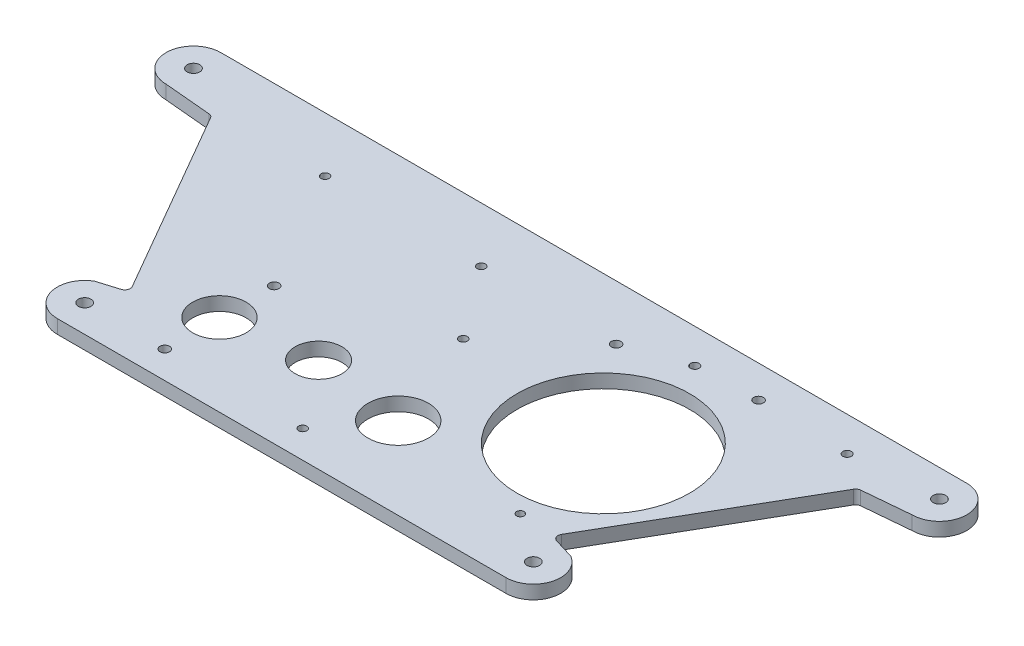
from build123d import *

# Parameters (mm, degrees)
SKETCH1_R           = 2.921
SKETCH1_R_2         = 2.2352
SKETCH1_R_3         = 12.3825
SKETCH1_R_4         = 10.8585
SKETCH1_R_5         = 14.0335
SKETCH1_R_6         = 1.7653
SKETCH1_R_7         = 40.0685
SKETCH1_R_8         = 1.9939
BOSS_EXTRUDE1_DEPTH = 6.35
SKETCH2_R           = 1.89865
CUT_EXTRUDE1_DEPTH  = 200.611442467
FILLET1_R           = 2.54


with BuildPart() as part:
    # Sketch1 → Boss-Extrude1 (new body)
    with BuildSketch(Plane(origin=(0, 0, 0), x_dir=(1, 0, 0), z_dir=(0, 1, 0))):
        with BuildLine():
            ThreePointArc((-173.185393891, 72.463962089), (-185.885393891, 59.763962089), (-173.185393891, 47.063962089))
            Line((-173.185393891, 47.063962089), (-149.978045472, 44.967655518))
            Line((-149.978045472, 44.967655518), (-98.053869436, -44.967655518))
            Line((-98.053869436, -44.967655518), (-110.525914692, -48.765439461))
            ThreePointArc((-110.525914692, -48.765439461), (-116.443172686, -63.050963961), (-104.175914692, -72.463962089))
            Line((-104.175914692, -72.463962089), (104.175914692, -72.463962089))
            ThreePointArc((104.175914692, -72.463962089), (116.443172686, -63.050963961), (110.525914692, -48.765439461))
            Line((110.525914692, -48.765439461), (98.053869436, -44.967655518))
            Line((98.053869436, -44.967655518), (149.978045472, 44.967655518))
            Line((149.978045472, 44.967655518), (173.185393891, 47.063962089))
            ThreePointArc((173.185393891, 47.063962089), (185.885393891, 59.763962089), (173.185393891, 72.463962089))
            Line((173.185393891, 72.463962089), (-173.185393891, 72.463962089))
        make_face()
        with Locations(Location((173.185393891, 59.763962089, 0), (0, 0, 270))):
            Circle(SKETCH1_R, mode=Mode.SUBTRACT)
        with Locations(Location((-104.175914692, -59.763962089, 0), (0, 0, 270))):
            Circle(SKETCH1_R, mode=Mode.SUBTRACT)
        with Locations(Location((-66.986243512, -59.763962089, 0), (0, 0, 270))):
            Circle(SKETCH1_R_2, mode=Mode.SUBTRACT)
        with Locations(Location((-66.986243512, -34.363962089, 0), (0, 0, 270))):
            Circle(SKETCH1_R_3, mode=Mode.SUBTRACT)
        with Locations(Location((-26.765079253, -28.544379147, 0), (0, 0, 270))):
            Circle(SKETCH1_R_4, mode=Mode.SUBTRACT)
        with Locations(Location((-66.986243512, -8.963962089, 0), (0, 0, 270))):
            Circle(SKETCH1_R_2, mode=Mode.SUBTRACT)
        with Locations(Location((16.020956488, -34.363962089, 0), (0, 0, 270))):
            Circle(SKETCH1_R_5, mode=Mode.SUBTRACT)
        with Locations(Location((81.81843836, -43.438397329, 0), (0, 0, 270))):
            Circle(SKETCH1_R_6, mode=Mode.SUBTRACT)
        with Locations(Location((-173.185393891, 59.763962089, 0), (0, 0, 270))):
            Circle(SKETCH1_R, mode=Mode.SUBTRACT)
        with Locations(Location((72.790674122, 4.112206637, 0), (0, 0, 270))):
            Circle(SKETCH1_R_7, mode=Mode.SUBTRACT)
        with Locations(Location((35.857528241, 46.975232392, 0), (0, 0, 270))):
            Circle(SKETCH1_R_2, mode=Mode.SUBTRACT)
        with Locations(Location((62.841482041, 56.516110851, 0), (0, 0, 270))):
            Circle(SKETCH1_R_8, mode=Mode.SUBTRACT)
        with Locations(Location((91.444570369, 57.528762089, 0), (0, 0, 270))):
            Circle(SKETCH1_R_2, mode=Mode.SUBTRACT)
        with Locations(Location((133.608398757, 56.516110851, 0), (0, 0, 270))):
            Circle(SKETCH1_R_8, mode=Mode.SUBTRACT)
        with Locations(Location((104.175914692, -59.763962089, 0), (0, 0, 270))):
            Circle(SKETCH1_R, mode=Mode.SUBTRACT)
    extrude(amount=BOSS_EXTRUDE1_DEPTH)

    # Sketch2 → Cut-Extrude1 (cut, through all)
    with BuildSketch(Plane(origin=(0, 6.35, 0), x_dir=(1, 0, 0), z_dir=(0, 1, 0))):
        with Locations(Location((-99.282752504, 46.975232392, 0), (0, 0, 270))):
            Circle(SKETCH2_R)
        with Locations(Location((-26.765079253, 46.975232392, 0), (0, 0, 270))):
            Circle(SKETCH2_R)
        with Locations(Location((-3.029043512, -59.670924273, 0), (0, 0, 270))):
            Circle(SKETCH2_R)
        with Locations(Location((-1.772813917, 13.610193745, 0), (0, 0, 270))):
            Circle(SKETCH2_R)
    extrude(amount=-CUT_EXTRUDE1_DEPTH, mode=Mode.SUBTRACT)

    # Fillet1
    fillet1_edges = [part.edges().sort_by_distance(p)[0] for p in [
        (149.978045472, 3.175, -44.967655518),
        (98.053869436, 3.175, 44.967655518),
        (-98.053869436, 3.175, 44.967655518),
        (-149.978045472, 3.175, -44.967655518),
    ]]
    fillet(fillet1_edges, radius=FILLET1_R)


solid = part.part
